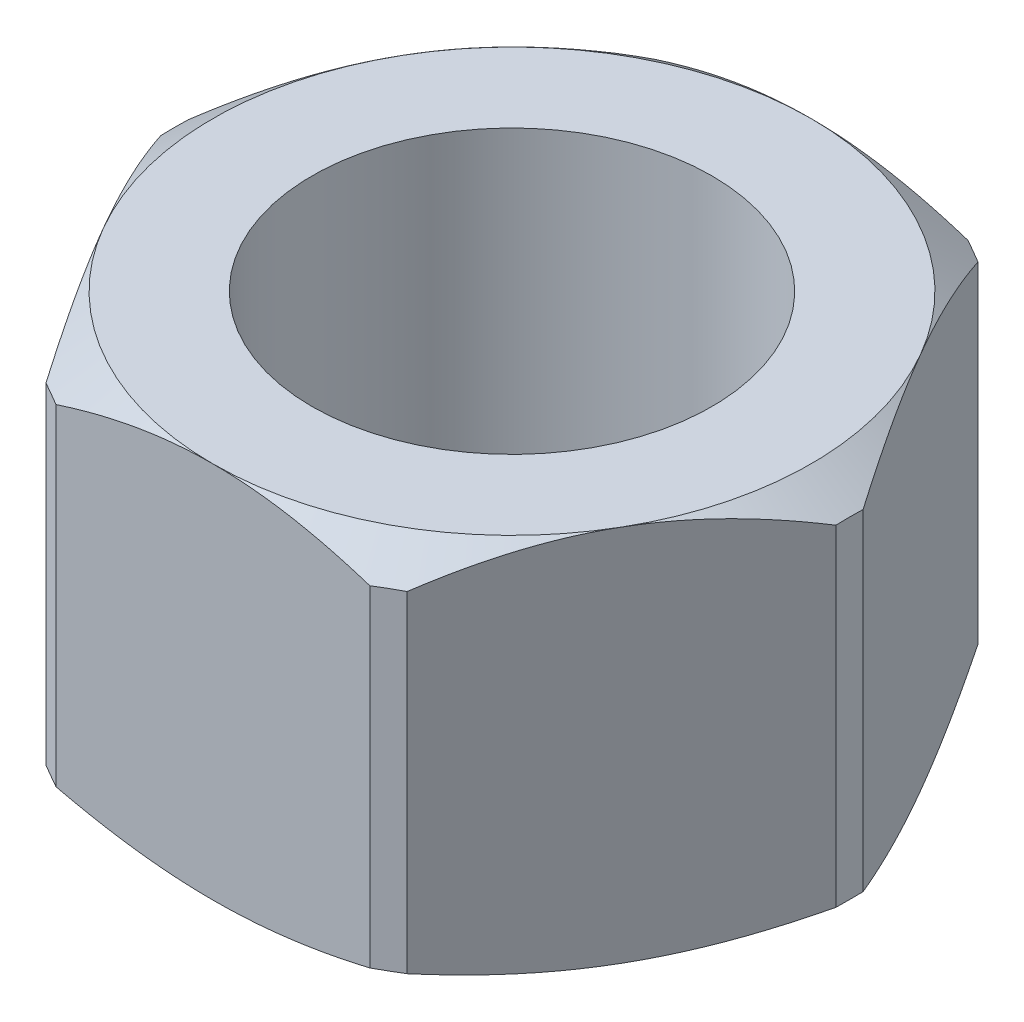
from build123d import *

# Parameters (mm, degrees)
CROQUIS1_R              = 6.35
SALIENTE_EXTRUIR1_DEPTH = 12
CROQUIS2_R              = 52.802243625
CROQUIS2_R_2            = 9.5
CORTAR_EXTRUIR1_DEPTH   = 12
CORTAR_EXTRUIR1_DRAFT   = -55
CROQUIS3_R              = 41.337917096
CROQUIS3_R_2            = 9.5
CORTAR_EXTRUIR2_DEPTH   = 12
CORTAR_EXTRUIR2_DRAFT   = -63
CORTAR_EXTRUIR3_REACH   = 20.83
MATRIZC1_COUNT          = 6


with BuildPart() as part:
    # Croquis1 → Saliente-Extruir1 (new body)
    with BuildSketch(Plane(origin=(0, 0, 0), x_dir=(1, 0, 0), z_dir=(0, 1, 0))):
        Polygon((10.969655115, 0), (5.484827557, 9.5), (-5.484827557, 9.5), (-10.969655115, 0), (-5.484827557, -9.5), (5.484827557, -9.5), align=None)
        with Locations(Location((0, 0, 0), (0, 0, 270))):
            Circle(CROQUIS1_R, mode=Mode.SUBTRACT)
    extrude(amount=SALIENTE_EXTRUIR1_DEPTH)


with BuildPart() as cortar_extruir1_tool:
    # Croquis2 → Cortar-Extruir1 (with draft: the straight prism first)
    with BuildSketch(Plane(origin=(0, 12, 0), x_dir=(1, 0, 0), z_dir=(0, 1, 0))):
        Circle(CROQUIS2_R)
        Circle(CROQUIS2_R_2, mode=Mode.SUBTRACT)
    extrude(amount=-CORTAR_EXTRUIR1_DEPTH)
    # Cortar-Extruir1: the draft: its side faces are tilted about the plane it starts from
    cortar_extruir1_sides = [cortar_extruir1_tool.faces().sort_by_distance(p)[0] for p in [
        (-52.802243625, 6, 0),
        (-9.5, 6, 0),
    ]]
    draft(cortar_extruir1_sides, Plane(origin=(0, 12, 0), x_dir=(1, 0, 0), z_dir=(0, 1, 0)), CORTAR_EXTRUIR1_DRAFT)


with BuildPart() as part_1:
    add(part.part)

    # Cortar-Extruir1: cut by cortar_extruir1_tool
    add(cortar_extruir1_tool.part, mode=Mode.SUBTRACT)


with BuildPart() as cortar_extruir2_tool:
    # Croquis3 → Cortar-Extruir2 (with draft: the straight prism first)
    with BuildSketch(Plane.XZ):
        Circle(CROQUIS3_R)
        Circle(CROQUIS3_R_2, mode=Mode.SUBTRACT)
    extrude(amount=-CORTAR_EXTRUIR2_DEPTH)
    # Cortar-Extruir2: the draft: its side faces are tilted about the plane it starts from
    cortar_extruir2_sides = [cortar_extruir2_tool.faces().sort_by_distance(p)[0] for p in [
        (-41.337917096, 6, 0),
        (-9.5, 6, 0),
    ]]
    draft(cortar_extruir2_sides, Plane.XZ, CORTAR_EXTRUIR2_DRAFT)


with BuildPart() as part_2:
    add(part_1.part)

    # Cortar-Extruir2: cut by cortar_extruir2_tool
    add(cortar_extruir2_tool.part, mode=Mode.SUBTRACT)

    # Cortar-Extruir3: up to this cone (the profile starts inside it)
    cortar_extruir3_end = Plane(origin=(0, 12, 0), z_dir=(0, 1, 0)).offset(-16.84049077) * Cone(1.963e-06, 139.780687907, 71.221816836, align=(Align.CENTER, Align.CENTER, Align.MIN), mode=Mode.PRIVATE)
    # Croquis4 → Cortar-Extruir3 (cut, up to the surface)
    with BuildSketch(Plane(origin=(0, 12, 0), x_dir=(1, 0, 0), z_dir=(0, 1, 0)), mode=Mode.PRIVATE) as cortar_extruir3_sk1:
        Polygon((-5.359827557, 9.283493649), (-6.723359894, 8.496257887), (-7.318521333, 9.527107738), (-4.730369323, 11.021377998), (-4.135207884, 9.990528147), align=None)
    cortar_extruir3_tool1 = extrude(cortar_extruir3_sk1.sketch, amount=-CORTAR_EXTRUIR3_REACH, mode=Mode.PRIVATE) & cortar_extruir3_end
    cortar_extruir3 = cortar_extruir3_tool1.solids().sort_by_distance((-5.726865, 12, -9.758818))[0]
    add(cortar_extruir3, mode=Mode.SUBTRACT)

    # MatrizC1: Cortar-Extruir3 ×6 about axis
    matrizc1_axis = Axis((0, 12, 0), (0, 1, 0))
    for i in range(1, MATRIZC1_COUNT):
        add(cortar_extruir3.rotate(matrizc1_axis, i * 360 / MATRIZC1_COUNT), mode=Mode.SUBTRACT)


solid = part_2.part
